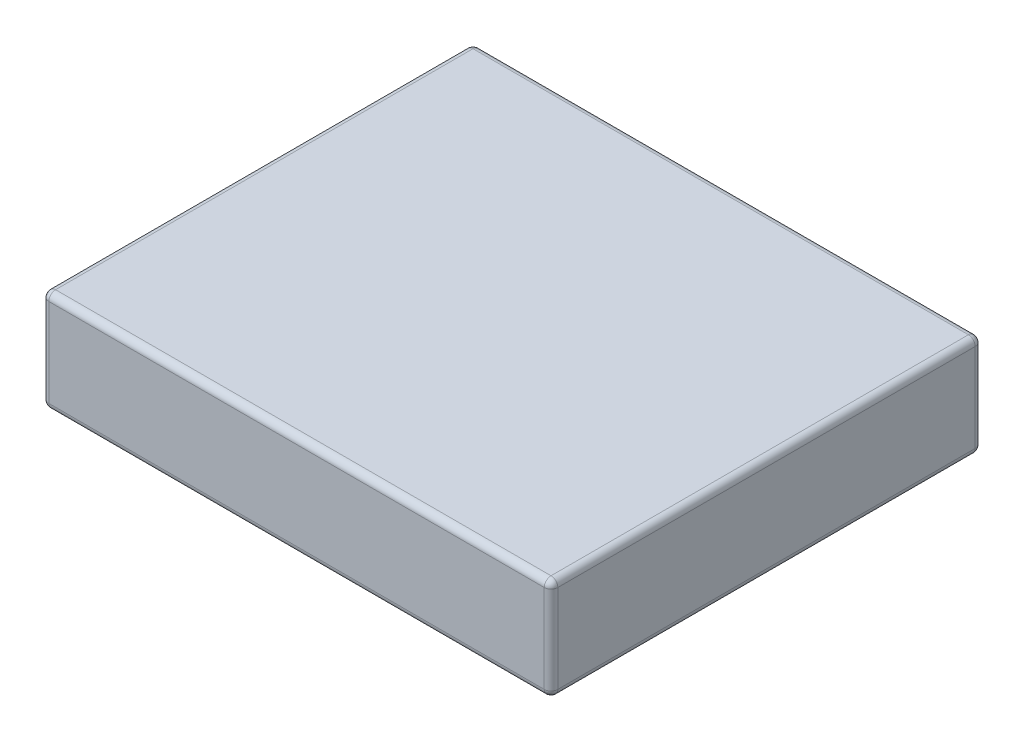
from build123d import *

# Parameters (mm, degrees)
BOSS_EXTRUDE1_DEPTH      = 3
BOSS_EXTRUDE1_DEPTH_BACK = 3
SKETCH1_W                = 30
SKETCH1_H                = 25.4
FILLET1_R                = 0.4


with BuildPart() as part:
    # Sketch1 → Boss-Extrude1 (new, two sides: drawn at the far end of the back side and taken through both)
    with BuildSketch(Plane(origin=(0, 0, 0), x_dir=(1, 0, 0), z_dir=(0, 1, 0)).offset(-BOSS_EXTRUDE1_DEPTH_BACK)):
        Rectangle(SKETCH1_W, SKETCH1_H)
    extrude(amount=BOSS_EXTRUDE1_DEPTH + BOSS_EXTRUDE1_DEPTH_BACK)

    # Fillet1
    fillet1_edges = [part.edges().sort_by_distance(p)[0] for p in [
        (15, 0, 12.7),
        (15, 0, -12.7),
        (-15, 0, -12.7),
        (-15, 0, 12.7),
        (0, 3, -12.7),
        (15, 3, 0),
        (0, 3, 12.7),
        (-15, 3, 0),
        (0, -3, 12.7),
        (15, -3, 0),
        (0, -3, -12.7),
        (-15, -3, 0),
    ]]
    fillet(fillet1_edges, radius=FILLET1_R)


solid = part.part
